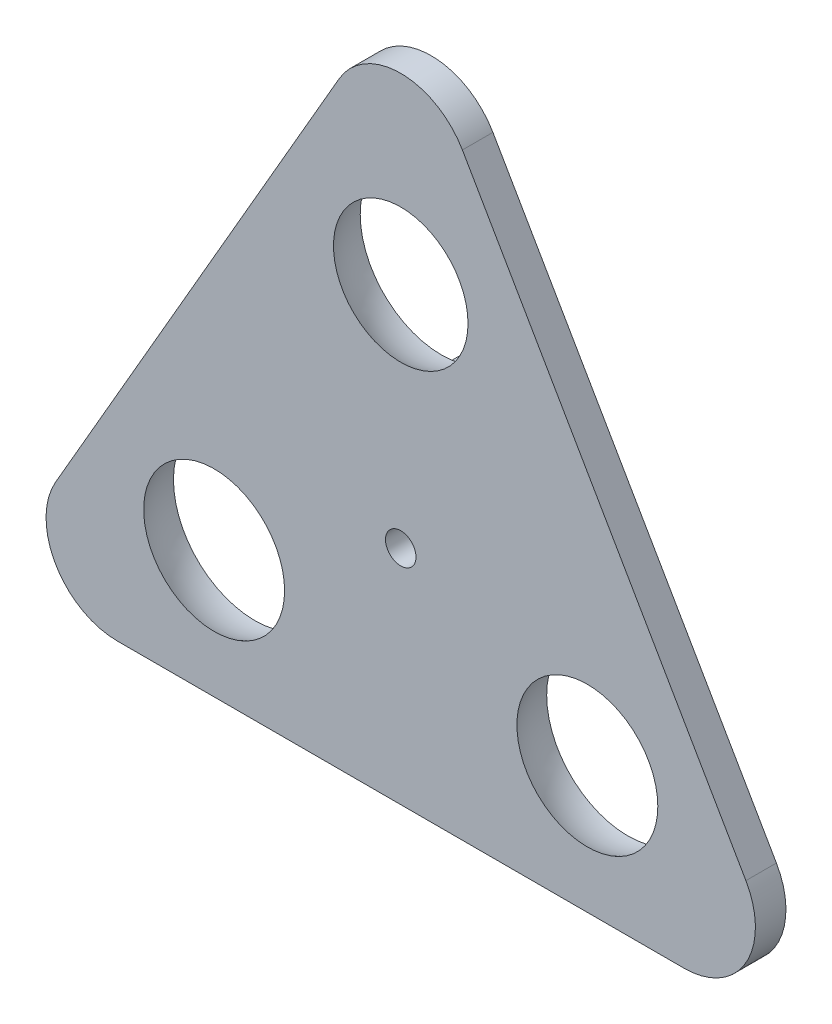
from build123d import *

# Parameters (mm, degrees)
BOSS_EXTRUDE1_DEPTH = 3
FILLET4_R           = 7
FILLET5_R           = 7
FILLET6_R           = 7
SKETCH6_R           = 10
BOSS_EXTRUDE2_DEPTH = 1
SKETCH10_W          = 3
SKETCH10_H          = 15
BOSS_EXTRUDE3_DEPTH = 9
SKETCH11_R          = 1.5
CUT_EXTRUDE4_DEPTH  = 14
SKETCH13_R          = 1.5
CUT_EXTRUDE5_DEPTH  = 10


with BuildPart() as part:
    # Sketch1 → Boss-Extrude1 (new body)
    with BuildSketch(Plane.XY):
        Polygon((0, 0), (80, 0), (40, 69.282032303), align=None)
    extrude(amount=BOSS_EXTRUDE1_DEPTH)

    # Fillet4
    fillet4_edges = [part.edges().sort_by_distance(p)[0] for p in [
        (0, 0, 1.5),
    ]]
    fillet(fillet4_edges, radius=FILLET4_R)

    # Fillet5
    fillet5_edges = [part.edges().sort_by_distance(p)[0] for p in [
        (80, 0, 1.5),
    ]]
    fillet(fillet5_edges, radius=FILLET5_R)

    # Fillet6
    fillet6_edges = [part.edges().sort_by_distance(p)[0] for p in [
        (40, 69.282032303, 1.5),
    ]]
    fillet(fillet6_edges, radius=FILLET6_R)

    # Sketch6 → Boss-Extrude2 (add)
    with BuildSketch(Plane(origin=(0, 0, 0), x_dir=(-1, 0, 0), z_dir=(0, 0, -1))):
        with Locations(Location((-40, 44.282032303, 0), (0, 0, 180))):
            Circle(SKETCH6_R)
        with Locations(Location((-58.349364905, 12.5, 0), (0, 0, 180))):
            Circle(SKETCH6_R)
        with Locations(Location((-21.650635095, 12.5, 0), (0, 0, 180))):
            Circle(SKETCH6_R)
    extrude(amount=BOSS_EXTRUDE2_DEPTH)

    # Sketch7 → Cut-Revolve2 (revolve, cut)
    with BuildSketch(Plane(origin=(0, 0, -1.5), x_dir=(-1, 0, 0), z_dir=(0, 0, -1))):
        with BuildLine():
            Line((-40, 52.282032303), (-40, 36.282032303))
            ThreePointArc((-40, 36.282032303), (-32, 44.282032303), (-40, 52.282032303))
        make_face()
    revolve(axis=Axis((40, 52.282032303, -1.5), (0, -1, 0)), mode=Mode.SUBTRACT)

    # Sketch8 → Cut-Revolve3 (revolve, cut)
    with BuildSketch(Plane(origin=(0, 0, -1), x_dir=(-1, 0, 0), z_dir=(0, 0, -1))):
        with BuildLine():
            Line((-58.349364905, 20.5), (-58.349364905, 4.5))
            ThreePointArc((-58.349364905, 4.5), (-50.349364905, 12.5), (-58.349364905, 20.5))
        make_face()
    revolve(axis=Axis((58.349364905, 20.5, -1), (0, -1, 0)), mode=Mode.SUBTRACT)

    # Sketch9 → Cut-Revolve4 (revolve, cut)
    with BuildSketch(Plane(origin=(0, 0, -1), x_dir=(-1, 0, 0), z_dir=(0, 0, -1))):
        with BuildLine():
            Line((-21.650635095, 20.5), (-21.650635095, 4.5))
            ThreePointArc((-21.650635095, 4.5), (-13.650635095, 12.5), (-21.650635095, 20.5))
        make_face()
    revolve(axis=Axis((21.650635095, 20.5, -1), (0, -1, 0)), mode=Mode.SUBTRACT)

    # Sketch10 → Boss-Extrude3 (add)
    with BuildSketch(Plane(origin=(0, 0, 0), x_dir=(-1, 0, 0), z_dir=(0, 0, -1))):
        with Locations((-35.5, 21.828790282)):
            Rectangle(SKETCH10_W, SKETCH10_H)
        with Locations((-44.5, 21.828790282)):
            Rectangle(SKETCH10_W, SKETCH10_H)
    extrude(amount=BOSS_EXTRUDE3_DEPTH)

    # Sketch11 → Cut-Extrude4 (cut)
    with BuildSketch(Plane.ZY.offset(-34)):
        with Locations((-4.5, 24.828790282)):
            Circle(SKETCH11_R)
        with Locations((-4.5, 18.828790282)):
            Circle(SKETCH11_R)
    extrude(amount=-CUT_EXTRUDE4_DEPTH, mode=Mode.SUBTRACT)

    # Sketch13 → Cut-Extrude5 (cut)
    with BuildSketch(Plane.XY.offset(3)):
        with Locations((40, 21.828790282)):
            Circle(SKETCH13_R)
    extrude(amount=-CUT_EXTRUDE5_DEPTH, mode=Mode.SUBTRACT)


solid = part.part
